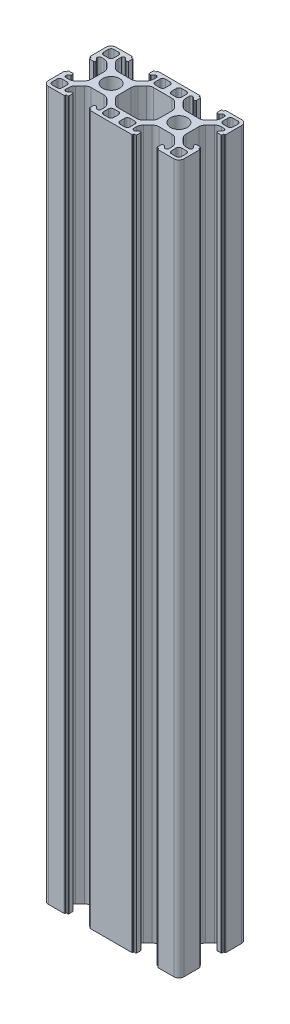
from build123d import *

# Parameters (mm, degrees)
EXTRUDE_1_DEPTH = 209


with BuildPart() as part:
    # Эскиз1 → Бобышка-Вытянуть1 (new body)
    with BuildSketch(Plane(origin=(0, 0, 0), x_dir=(1, 0, 0), z_dir=(0, 1, 0))):
        with BuildLine():
            Line((9.247825015, 4.683728486), (11.146605684, 4.683728486))
            ThreePointArc((11.146605684, 4.683728486), (11.911972549, 4.835969421), (12.560819246, 5.269514923))
            Line((12.560819246, 5.269514923), (13.862038577, 6.570734254))
            ThreePointArc((13.862038577, 6.570734254), (14.29558408, 7.219580952), (14.447825015, 7.984947817))
            Line((14.447825015, 7.984947817), (14.447825015, 8.883728486))
            ThreePointArc((14.447825015, 8.883728486), (14.301378405, 9.237281876), (13.947825015, 9.383728486))
            Line((13.947825015, 9.383728486), (13.844931796, 9.383728486))
            ThreePointArc((13.844931796, 9.383728486), (13.65359008, 9.345668252), (13.491378405, 9.237281876))
            Line((13.491378405, 9.237281876), (13.01104832, 8.75695179))
            ThreePointArc((13.01104832, 8.75695179), (12.929942482, 8.702758603), (12.834271624, 8.683728486))
            Line((12.834271624, 8.683728486), (12.547825015, 8.683728486))
            ThreePointArc((12.547825015, 8.683728486), (12.37104832, 8.75695179), (12.297825015, 8.933728486))
            Line((12.297825015, 8.933728486), (12.297825015, 10.082799306))
            ThreePointArc((12.297825015, 10.082799306), (12.341758998, 10.188865323), (12.447825015, 10.232799306))
            Line((12.447825015, 10.232799306), (12.947825015, 10.232799306))
            Line((12.947825015, 10.232799306), (12.947825015, 10.533728486))
            ThreePointArc((12.947825015, 10.533728486), (12.991758998, 10.639794503), (13.097825015, 10.683728486))
            Line((13.097825015, 10.683728486), (17.747825015, 10.683728486))
            ThreePointArc((17.747825015, 10.683728486), (18.808485187, 10.244388658), (19.247825015, 9.183728486))
            Line((19.247825015, 9.183728486), (19.247825015, 4.533728486))
            ThreePointArc((19.247825015, 4.533728486), (19.203891032, 4.427662469), (19.097825015, 4.383728486))
            Line((19.097825015, 4.383728486), (18.796895835, 4.383728486))
            Line((18.796895835, 4.383728486), (18.796895835, 3.883728486))
            ThreePointArc((18.796895835, 3.883728486), (18.752961853, 3.777662469), (18.646895835, 3.733728486))
            Line((18.646895835, 3.733728486), (17.497825015, 3.733728486))
            ThreePointArc((17.497825015, 3.733728486), (17.32104832, 3.80695179), (17.247825015, 3.983728486))
            Line((17.247825015, 3.983728486), (17.247825015, 4.270175095))
            ThreePointArc((17.247825015, 4.270175095), (17.266855132, 4.365845953), (17.32104832, 4.44695179))
            Line((17.32104832, 4.44695179), (17.801378405, 4.927281876))
            ThreePointArc((17.801378405, 4.927281876), (17.909764781, 5.089493551), (17.947825015, 5.280835267))
            Line((17.947825015, 5.280835267), (17.947825015, 5.383728486))
            ThreePointArc((17.947825015, 5.383728486), (17.801378405, 5.737281876), (17.447825015, 5.883728486))
            Line((17.447825015, 5.883728486), (16.549044346, 5.883728486))
            ThreePointArc((16.549044346, 5.883728486), (15.783677481, 5.731487551), (15.134830783, 5.297942048))
            Line((15.134830783, 5.297942048), (13.833611452, 3.996722717))
            ThreePointArc((13.833611452, 3.996722717), (13.40006595, 3.34787602), (13.247825015, 2.582509155))
            Line((13.247825015, 2.582509155), (13.247825015, 0.683728486))
            Line((13.247825015, 0.683728486), (13.247825015, -1.215052183))
            ThreePointArc((13.247825015, -1.215052183), (13.40006595, -1.980419048), (13.833611452, -2.629265746))
            Line((13.833611452, -2.629265746), (15.134830783, -3.930485077))
            ThreePointArc((15.134830783, -3.930485077), (15.783677481, -4.364030579), (16.549044346, -4.516271514))
            Line((16.549044346, -4.516271514), (17.447825015, -4.516271514))
            ThreePointArc((17.447825015, -4.516271514), (17.801378405, -4.369824905), (17.947825015, -4.016271514))
            Line((17.947825015, -4.016271514), (17.947825015, -3.913378295))
            ThreePointArc((17.947825015, -3.913378295), (17.909764781, -3.722036579), (17.801378405, -3.559824905))
            Line((17.801378405, -3.559824905), (17.32104832, -3.079494819))
            ThreePointArc((17.32104832, -3.079494819), (17.266855132, -2.998388982), (17.247825015, -2.902718124))
            Line((17.247825015, -2.902718124), (17.247825015, -2.616271514))
            ThreePointArc((17.247825015, -2.616271514), (17.32104832, -2.439494819), (17.497825015, -2.366271514))
            Line((17.497825015, -2.366271514), (18.646895835, -2.366271514))
            ThreePointArc((18.646895835, -2.366271514), (18.752961853, -2.410205497), (18.796895835, -2.516271514))
            Line((18.796895835, -2.516271514), (18.796895835, -3.016271514))
            Line((18.796895835, -3.016271514), (19.097825015, -3.016271514))
            ThreePointArc((19.097825015, -3.016271514), (19.203891032, -3.060205497), (19.247825015, -3.166271514))
            Line((19.247825015, -3.166271514), (19.247825015, -7.816271514))
            ThreePointArc((19.247825015, -7.816271514), (18.808485187, -8.876931686), (17.747825015, -9.316271514))
            Line((17.747825015, -9.316271514), (13.097825015, -9.316271514))
            ThreePointArc((13.097825015, -9.316271514), (12.991758998, -9.272337531), (12.947825015, -9.166271514))
            Line((12.947825015, -9.166271514), (12.947825015, -8.865342335))
            Line((12.947825015, -8.865342335), (12.447825015, -8.865342335))
            ThreePointArc((12.447825015, -8.865342335), (12.341758998, -8.821408352), (12.297825015, -8.715342335))
            Line((12.297825015, -8.715342335), (12.297825015, -7.566271514))
            ThreePointArc((12.297825015, -7.566271514), (12.37104832, -7.389494819), (12.547825015, -7.316271514))
            Line((12.547825015, -7.316271514), (12.834271624, -7.316271514))
            ThreePointArc((12.834271624, -7.316271514), (12.929942482, -7.335301631), (13.01104832, -7.389494819))
            Line((13.01104832, -7.389494819), (13.491378405, -7.869824905))
            ThreePointArc((13.491378405, -7.869824905), (13.65359008, -7.978211281), (13.844931796, -8.016271514))
            Line((13.844931796, -8.016271514), (13.947825015, -8.016271514))
            ThreePointArc((13.947825015, -8.016271514), (14.301378405, -7.869824905), (14.447825015, -7.516271514))
            Line((14.447825015, -7.516271514), (14.447825015, -6.617490845))
            ThreePointArc((14.447825015, -6.617490845), (14.29558408, -5.85212398), (13.862038577, -5.203277283))
            Line((13.862038577, -5.203277283), (12.560819246, -3.902057952))
            ThreePointArc((12.560819246, -3.902057952), (11.911972549, -3.468512449), (11.146605684, -3.316271514))
            Line((11.146605684, -3.316271514), (9.247825015, -3.316271514))
            Line((9.247825015, -3.316271514), (7.349044346, -3.316271514))
            ThreePointArc((7.349044346, -3.316271514), (6.583677481, -3.468512449), (5.934830783, -3.902057952))
            Line((5.934830783, -3.902057952), (4.633611452, -5.203277283))
            ThreePointArc((4.633611452, -5.203277283), (4.20006595, -5.85212398), (4.047825015, -6.617490845))
            Line((4.047825015, -6.617490845), (4.047825015, -7.516271514))
            ThreePointArc((4.047825015, -7.516271514), (4.194271624, -7.869824905), (4.547825015, -8.016271514))
            Line((4.547825015, -8.016271514), (4.650718234, -8.016271514))
            ThreePointArc((4.650718234, -8.016271514), (4.84205995, -7.978211281), (5.004271624, -7.869824905))
            Line((5.004271624, -7.869824905), (5.48460171, -7.389494819))
            ThreePointArc((5.48460171, -7.389494819), (5.565707547, -7.335301631), (5.661378405, -7.316271514))
            Line((5.661378405, -7.316271514), (5.947825015, -7.316271514))
            ThreePointArc((5.947825015, -7.316271514), (6.12460171, -7.389494819), (6.197825015, -7.566271514))
            Line((6.197825015, -7.566271514), (6.197825015, -8.715342335))
            ThreePointArc((6.197825015, -8.715342335), (6.153891032, -8.821408352), (6.047825015, -8.865342335))
            Line((6.047825015, -8.865342335), (5.547825015, -8.865342335))
            Line((5.547825015, -8.865342335), (5.547825015, -9.166271514))
            ThreePointArc((5.547825015, -9.166271514), (5.503891032, -9.272337531), (5.397825015, -9.316271514))
            Line((5.397825015, -9.316271514), (0.747825015, -9.316271514))
            Line((0.747825015, -9.316271514), (-2.252174985, -9.316271514))
            Line((-2.252174985, -9.316271514), (-6.902174985, -9.316271514))
            ThreePointArc((-6.902174985, -9.316271514), (-7.008241002, -9.272337531), (-7.052174985, -9.166271514))
            Line((-7.052174985, -9.166271514), (-7.052174985, -8.865342335))
            Line((-7.052174985, -8.865342335), (-7.552174985, -8.865342335))
            ThreePointArc((-7.552174985, -8.865342335), (-7.658241002, -8.821408352), (-7.702174985, -8.715342335))
            Line((-7.702174985, -8.715342335), (-7.702174985, -7.566271514))
            ThreePointArc((-7.702174985, -7.566271514), (-7.62895168, -7.389494819), (-7.452174985, -7.316271514))
            Line((-7.452174985, -7.316271514), (-7.165728376, -7.316271514))
            ThreePointArc((-7.165728376, -7.316271514), (-7.070057518, -7.335301631), (-6.98895168, -7.389494819))
            Line((-6.98895168, -7.389494819), (-6.508621595, -7.869824905))
            ThreePointArc((-6.508621595, -7.869824905), (-6.34640992, -7.978211281), (-6.155068204, -8.016271514))
            Line((-6.155068204, -8.016271514), (-6.052174985, -8.016271514))
            ThreePointArc((-6.052174985, -8.016271514), (-5.698621595, -7.869824905), (-5.552174985, -7.516271514))
            Line((-5.552174985, -7.516271514), (-5.552174985, -6.617490845))
            ThreePointArc((-5.552174985, -6.617490845), (-5.70441592, -5.85212398), (-6.137961423, -5.203277283))
            Line((-6.137961423, -5.203277283), (-7.439180754, -3.902057952))
            ThreePointArc((-7.439180754, -3.902057952), (-8.088027451, -3.468512449), (-8.853394316, -3.316271514))
            Line((-8.853394316, -3.316271514), (-10.752174985, -3.316271514))
            Line((-10.752174985, -3.316271514), (-12.650955654, -3.316271514))
            ThreePointArc((-12.650955654, -3.316271514), (-13.416322519, -3.468512449), (-14.065169217, -3.902057952))
            Line((-14.065169217, -3.902057952), (-15.366388548, -5.203277283))
            ThreePointArc((-15.366388548, -5.203277283), (-15.79993405, -5.85212398), (-15.952174985, -6.617490845))
            Line((-15.952174985, -6.617490845), (-15.952174985, -7.516271514))
            ThreePointArc((-15.952174985, -7.516271514), (-15.805728376, -7.869824905), (-15.452174985, -8.016271514))
            Line((-15.452174985, -8.016271514), (-15.349281766, -8.016271514))
            ThreePointArc((-15.349281766, -8.016271514), (-15.15794005, -7.978211281), (-14.995728376, -7.869824905))
            Line((-14.995728376, -7.869824905), (-14.51539829, -7.389494819))
            ThreePointArc((-14.51539829, -7.389494819), (-14.434292453, -7.335301631), (-14.338621595, -7.316271514))
            Line((-14.338621595, -7.316271514), (-14.052174985, -7.316271514))
            ThreePointArc((-14.052174985, -7.316271514), (-13.87539829, -7.389494819), (-13.802174985, -7.566271514))
            Line((-13.802174985, -7.566271514), (-13.802174985, -8.715342335))
            ThreePointArc((-13.802174985, -8.715342335), (-13.846108968, -8.821408352), (-13.952174985, -8.865342335))
            Line((-13.952174985, -8.865342335), (-14.452174985, -8.865342335))
            Line((-14.452174985, -8.865342335), (-14.452174985, -9.166271514))
            ThreePointArc((-14.452174985, -9.166271514), (-14.496108968, -9.272337531), (-14.602174985, -9.316271514))
            Line((-14.602174985, -9.316271514), (-19.252174985, -9.316271514))
            ThreePointArc((-19.252174985, -9.316271514), (-20.312835157, -8.876931686), (-20.752174985, -7.816271514))
            Line((-20.752174985, -7.816271514), (-20.752174985, -3.166271514))
            ThreePointArc((-20.752174985, -3.166271514), (-20.708241002, -3.060205497), (-20.602174985, -3.016271514))
            Line((-20.602174985, -3.016271514), (-20.301245806, -3.016271514))
            Line((-20.301245806, -3.016271514), (-20.301245806, -2.516271514))
            ThreePointArc((-20.301245806, -2.516271514), (-20.257311823, -2.410205497), (-20.151245806, -2.366271514))
            Line((-20.151245806, -2.366271514), (-19.002174985, -2.366271514))
            ThreePointArc((-19.002174985, -2.366271514), (-18.82539829, -2.439494819), (-18.752174985, -2.616271514))
            Line((-18.752174985, -2.616271514), (-18.752174985, -2.902718124))
            ThreePointArc((-18.752174985, -2.902718124), (-18.771205102, -2.998388982), (-18.82539829, -3.079494819))
            Line((-18.82539829, -3.079494819), (-19.305728376, -3.559824905))
            ThreePointArc((-19.305728376, -3.559824905), (-19.414114751, -3.722036579), (-19.452174985, -3.913378295))
            Line((-19.452174985, -3.913378295), (-19.452174985, -4.016271514))
            ThreePointArc((-19.452174985, -4.016271514), (-19.305728376, -4.369824905), (-18.952174985, -4.516271514))
            Line((-18.952174985, -4.516271514), (-18.053394316, -4.516271514))
            ThreePointArc((-18.053394316, -4.516271514), (-17.288027451, -4.364030579), (-16.639180754, -3.930485077))
            Line((-16.639180754, -3.930485077), (-15.337961423, -2.629265746))
            ThreePointArc((-15.337961423, -2.629265746), (-14.90441592, -1.980419048), (-14.752174985, -1.215052183))
            Line((-14.752174985, -1.215052183), (-14.752174985, 0.683728486))
            Line((-14.752174985, 0.683728486), (-14.752174985, 2.582509155))
            ThreePointArc((-14.752174985, 2.582509155), (-14.90441592, 3.34787602), (-15.337961423, 3.996722717))
            Line((-15.337961423, 3.996722717), (-16.639180754, 5.297942048))
            ThreePointArc((-16.639180754, 5.297942048), (-17.288027451, 5.731487551), (-18.053394316, 5.883728486))
            Line((-18.053394316, 5.883728486), (-18.952174985, 5.883728486))
            ThreePointArc((-18.952174985, 5.883728486), (-19.305728376, 5.737281876), (-19.452174985, 5.383728486))
            Line((-19.452174985, 5.383728486), (-19.452174985, 5.280835267))
            ThreePointArc((-19.452174985, 5.280835267), (-19.414114751, 5.089493551), (-19.305728376, 4.927281876))
            Line((-19.305728376, 4.927281876), (-18.82539829, 4.44695179))
            ThreePointArc((-18.82539829, 4.44695179), (-18.771205102, 4.365845953), (-18.752174985, 4.270175095))
            Line((-18.752174985, 4.270175095), (-18.752174985, 3.983728486))
            ThreePointArc((-18.752174985, 3.983728486), (-18.82539829, 3.80695179), (-19.002174985, 3.733728486))
            Line((-19.002174985, 3.733728486), (-20.151245806, 3.733728486))
            ThreePointArc((-20.151245806, 3.733728486), (-20.257311823, 3.777662469), (-20.301245806, 3.883728486))
            Line((-20.301245806, 3.883728486), (-20.301245806, 4.383728486))
            Line((-20.301245806, 4.383728486), (-20.602174985, 4.383728486))
            ThreePointArc((-20.602174985, 4.383728486), (-20.708241002, 4.427662469), (-20.752174985, 4.533728486))
            Line((-20.752174985, 4.533728486), (-20.752174985, 9.183728486))
            ThreePointArc((-20.752174985, 9.183728486), (-20.312835157, 10.244388658), (-19.252174985, 10.683728486))
            Line((-19.252174985, 10.683728486), (-14.602174985, 10.683728486))
            ThreePointArc((-14.602174985, 10.683728486), (-14.496108968, 10.639794503), (-14.452174985, 10.533728486))
            Line((-14.452174985, 10.533728486), (-14.452174985, 10.232799306))
            Line((-14.452174985, 10.232799306), (-13.952174985, 10.232799306))
            ThreePointArc((-13.952174985, 10.232799306), (-13.846108968, 10.188865323), (-13.802174985, 10.082799306))
            Line((-13.802174985, 10.082799306), (-13.802174985, 8.933728486))
            ThreePointArc((-13.802174985, 8.933728486), (-13.87539829, 8.75695179), (-14.052174985, 8.683728486))
            Line((-14.052174985, 8.683728486), (-14.338621595, 8.683728486))
            ThreePointArc((-14.338621595, 8.683728486), (-14.434292453, 8.702758603), (-14.51539829, 8.75695179))
            Line((-14.51539829, 8.75695179), (-14.995728376, 9.237281876))
            ThreePointArc((-14.995728376, 9.237281876), (-15.15794005, 9.345668252), (-15.349281766, 9.383728486))
            Line((-15.349281766, 9.383728486), (-15.452174985, 9.383728486))
            ThreePointArc((-15.452174985, 9.383728486), (-15.805728376, 9.237281876), (-15.952174985, 8.883728486))
            Line((-15.952174985, 8.883728486), (-15.952174985, 7.984947817))
            ThreePointArc((-15.952174985, 7.984947817), (-15.79993405, 7.219580952), (-15.366388548, 6.570734254))
            Line((-15.366388548, 6.570734254), (-14.065169217, 5.269514923))
            ThreePointArc((-14.065169217, 5.269514923), (-13.416322519, 4.835969421), (-12.650955654, 4.683728486))
            Line((-12.650955654, 4.683728486), (-10.752174985, 4.683728486))
            Line((-10.752174985, 4.683728486), (-8.853394316, 4.683728486))
            ThreePointArc((-8.853394316, 4.683728486), (-8.088027451, 4.835969421), (-7.439180754, 5.269514923))
            Line((-7.439180754, 5.269514923), (-6.137961423, 6.570734254))
            ThreePointArc((-6.137961423, 6.570734254), (-5.70441592, 7.219580952), (-5.552174985, 7.984947817))
            Line((-5.552174985, 7.984947817), (-5.552174985, 8.883728486))
            ThreePointArc((-5.552174985, 8.883728486), (-5.698621595, 9.237281876), (-6.052174985, 9.383728486))
            Line((-6.052174985, 9.383728486), (-6.155068204, 9.383728486))
            ThreePointArc((-6.155068204, 9.383728486), (-6.34640992, 9.345668252), (-6.508621595, 9.237281876))
            Line((-6.508621595, 9.237281876), (-6.98895168, 8.75695179))
            ThreePointArc((-6.98895168, 8.75695179), (-7.070057518, 8.702758603), (-7.165728376, 8.683728486))
            Line((-7.165728376, 8.683728486), (-7.452174985, 8.683728486))
            ThreePointArc((-7.452174985, 8.683728486), (-7.62895168, 8.75695179), (-7.702174985, 8.933728486))
            Line((-7.702174985, 8.933728486), (-7.702174985, 10.082799306))
            ThreePointArc((-7.702174985, 10.082799306), (-7.658241002, 10.188865323), (-7.552174985, 10.232799306))
            Line((-7.552174985, 10.232799306), (-7.052174985, 10.232799306))
            Line((-7.052174985, 10.232799306), (-7.052174985, 10.533728486))
            ThreePointArc((-7.052174985, 10.533728486), (-7.008241002, 10.639794503), (-6.902174985, 10.683728486))
            Line((-6.902174985, 10.683728486), (-2.252174985, 10.683728486))
            Line((-2.252174985, 10.683728486), (0.747825015, 10.683728486))
            Line((0.747825015, 10.683728486), (5.397825015, 10.683728486))
            ThreePointArc((5.397825015, 10.683728486), (5.503891032, 10.639794503), (5.547825015, 10.533728486))
            Line((5.547825015, 10.533728486), (5.547825015, 10.232799306))
            Line((5.547825015, 10.232799306), (6.047825015, 10.232799306))
            ThreePointArc((6.047825015, 10.232799306), (6.153891032, 10.188865323), (6.197825015, 10.082799306))
            Line((6.197825015, 10.082799306), (6.197825015, 8.933728486))
            ThreePointArc((6.197825015, 8.933728486), (6.12460171, 8.75695179), (5.947825015, 8.683728486))
            Line((5.947825015, 8.683728486), (5.661378405, 8.683728486))
            ThreePointArc((5.661378405, 8.683728486), (5.565707547, 8.702758603), (5.48460171, 8.75695179))
            Line((5.48460171, 8.75695179), (5.004271624, 9.237281876))
            ThreePointArc((5.004271624, 9.237281876), (4.84205995, 9.345668252), (4.650718234, 9.383728486))
            Line((4.650718234, 9.383728486), (4.547825015, 9.383728486))
            ThreePointArc((4.547825015, 9.383728486), (4.194271624, 9.237281876), (4.047825015, 8.883728486))
            Line((4.047825015, 8.883728486), (4.047825015, 7.984947817))
            ThreePointArc((4.047825015, 7.984947817), (4.20006595, 7.219580952), (4.633611452, 6.570734254))
            Line((4.633611452, 6.570734254), (5.934830783, 5.269514923))
            ThreePointArc((5.934830783, 5.269514923), (6.583677481, 4.835969421), (7.349044346, 4.683728486))
            Line((7.349044346, 4.683728486), (9.247825015, 4.683728486))
        make_face()
        with BuildLine():
            Line((16.147825015, 6.783728486), (17.547825015, 6.783728486))
            ThreePointArc((17.547825015, 6.783728486), (18.11351044, 7.018043061), (18.347825015, 7.583728486))
            Line((18.347825015, 7.583728486), (18.347825015, 8.983728486))
            ThreePointArc((18.347825015, 8.983728486), (18.11351044, 9.549413911), (17.547825015, 9.783728486))
            Line((17.547825015, 9.783728486), (16.147825015, 9.783728486))
            ThreePointArc((16.147825015, 9.783728486), (15.58213959, 9.549413911), (15.347825015, 8.983728486))
            Line((15.347825015, 8.983728486), (15.347825015, 7.583728486))
            ThreePointArc((15.347825015, 7.583728486), (15.58213959, 7.018043061), (16.147825015, 6.783728486))
        make_face(mode=Mode.SUBTRACT)
        with BuildLine():
            Line((15.347825015, -6.216271514), (15.347825015, -7.616271514))
            ThreePointArc((15.347825015, -7.616271514), (15.58213959, -8.181956939), (16.147825015, -8.416271514))
            Line((16.147825015, -8.416271514), (17.547825015, -8.416271514))
            ThreePointArc((17.547825015, -8.416271514), (18.11351044, -8.181956939), (18.347825015, -7.616271514))
            Line((18.347825015, -7.616271514), (18.347825015, -6.216271514))
            ThreePointArc((18.347825015, -6.216271514), (18.11351044, -5.650586089), (17.547825015, -5.416271514))
            Line((17.547825015, -5.416271514), (16.147825015, -5.416271514))
            ThreePointArc((16.147825015, -5.416271514), (15.58213959, -5.650586089), (15.347825015, -6.216271514))
        make_face(mode=Mode.SUBTRACT)
        with BuildLine():
            Line((2.347825015, -5.416271514), (0.947825015, -5.416271514))
            ThreePointArc((0.947825015, -5.416271514), (0.38213959, -5.650586089), (0.147825015, -6.216271514))
            Line((0.147825015, -6.216271514), (0.147825015, -7.616271514))
            ThreePointArc((0.147825015, -7.616271514), (0.38213959, -8.181956939), (0.947825015, -8.416271514))
            Line((0.947825015, -8.416271514), (2.347825015, -8.416271514))
            ThreePointArc((2.347825015, -8.416271514), (2.91351044, -8.181956939), (3.147825015, -7.616271514))
            Line((3.147825015, -7.616271514), (3.147825015, -6.216271514))
            ThreePointArc((3.147825015, -6.216271514), (2.91351044, -5.650586089), (2.347825015, -5.416271514))
        make_face(mode=Mode.SUBTRACT)
        with BuildLine():
            Line((1.047825015, -4.516271514), (1.946605684, -4.516271514))
            ThreePointArc((1.946605684, -4.516271514), (2.711972549, -4.364030579), (3.360819246, -3.930485077))
            Line((3.360819246, -3.930485077), (4.662038577, -2.629265746))
            ThreePointArc((4.662038577, -2.629265746), (5.09558408, -1.980419048), (5.247825015, -1.215052183))
            Line((5.247825015, -1.215052183), (5.247825015, 0.683728486))
            Line((5.247825015, 0.683728486), (5.247825015, 2.582509155))
            ThreePointArc((5.247825015, 2.582509155), (5.09558408, 3.34787602), (4.662038577, 3.996722717))
            Line((4.662038577, 3.996722717), (3.360819246, 5.297942048))
            ThreePointArc((3.360819246, 5.297942048), (2.711972549, 5.731487551), (1.946605684, 5.883728486))
            Line((1.946605684, 5.883728486), (1.047825015, 5.883728486))
            Line((1.047825015, 5.883728486), (-2.552174985, 5.883728486))
            Line((-2.552174985, 5.883728486), (-3.450955654, 5.883728486))
            ThreePointArc((-3.450955654, 5.883728486), (-4.216322519, 5.731487551), (-4.865169217, 5.297942048))
            Line((-4.865169217, 5.297942048), (-6.166388548, 3.996722717))
            ThreePointArc((-6.166388548, 3.996722717), (-6.59993405, 3.34787602), (-6.752174985, 2.582509155))
            Line((-6.752174985, 2.582509155), (-6.752174985, 0.683728486))
            Line((-6.752174985, 0.683728486), (-6.752174985, -1.215052183))
            ThreePointArc((-6.752174985, -1.215052183), (-6.59993405, -1.980419048), (-6.166388548, -2.629265746))
            Line((-6.166388548, -2.629265746), (-4.865169217, -3.930485077))
            ThreePointArc((-4.865169217, -3.930485077), (-4.216322519, -4.364030579), (-3.450955654, -4.516271514))
            Line((-3.450955654, -4.516271514), (-2.552174985, -4.516271514))
            Line((-2.552174985, -4.516271514), (1.047825015, -4.516271514))
        make_face(mode=Mode.SUBTRACT)
        with BuildLine():
            Line((3.147825015, 7.583728486), (3.147825015, 8.983728486))
            ThreePointArc((3.147825015, 8.983728486), (2.91351044, 9.549413911), (2.347825015, 9.783728486))
            Line((2.347825015, 9.783728486), (0.947825015, 9.783728486))
            ThreePointArc((0.947825015, 9.783728486), (0.38213959, 9.549413911), (0.147825015, 8.983728486))
            Line((0.147825015, 8.983728486), (0.147825015, 7.583728486))
            ThreePointArc((0.147825015, 7.583728486), (0.38213959, 7.018043061), (0.947825015, 6.783728486))
            Line((0.947825015, 6.783728486), (2.347825015, 6.783728486))
            ThreePointArc((2.347825015, 6.783728486), (2.91351044, 7.018043061), (3.147825015, 7.583728486))
        make_face(mode=Mode.SUBTRACT)
        with BuildLine():
            Line((-2.452174985, 9.783728486), (-3.852174985, 9.783728486))
            ThreePointArc((-3.852174985, 9.783728486), (-4.41786041, 9.549413911), (-4.652174985, 8.983728486))
            Line((-4.652174985, 8.983728486), (-4.652174985, 7.583728486))
            ThreePointArc((-4.652174985, 7.583728486), (-4.41786041, 7.018043061), (-3.852174985, 6.783728486))
            Line((-3.852174985, 6.783728486), (-2.452174985, 6.783728486))
            ThreePointArc((-2.452174985, 6.783728486), (-1.88648956, 7.018043061), (-1.652174985, 7.583728486))
            Line((-1.652174985, 7.583728486), (-1.652174985, 8.983728486))
            ThreePointArc((-1.652174985, 8.983728486), (-1.88648956, 9.549413911), (-2.452174985, 9.783728486))
        make_face(mode=Mode.SUBTRACT)
        with BuildLine():
            Line((-1.652174985, -7.616271514), (-1.652174985, -6.216271514))
            ThreePointArc((-1.652174985, -6.216271514), (-1.88648956, -5.650586089), (-2.452174985, -5.416271514))
            Line((-2.452174985, -5.416271514), (-3.852174985, -5.416271514))
            ThreePointArc((-3.852174985, -5.416271514), (-4.41786041, -5.650586089), (-4.652174985, -6.216271514))
            Line((-4.652174985, -6.216271514), (-4.652174985, -7.616271514))
            ThreePointArc((-4.652174985, -7.616271514), (-4.41786041, -8.181956939), (-3.852174985, -8.416271514))
            Line((-3.852174985, -8.416271514), (-2.452174985, -8.416271514))
            ThreePointArc((-2.452174985, -8.416271514), (-1.88648956, -8.181956939), (-1.652174985, -7.616271514))
        make_face(mode=Mode.SUBTRACT)
        with BuildLine():
            Line((-19.052174985, -8.416271514), (-17.652174985, -8.416271514))
            ThreePointArc((-17.652174985, -8.416271514), (-17.08648956, -8.181956939), (-16.852174985, -7.616271514))
            Line((-16.852174985, -7.616271514), (-16.852174985, -6.216271514))
            ThreePointArc((-16.852174985, -6.216271514), (-17.08648956, -5.650586089), (-17.652174985, -5.416271514))
            Line((-17.652174985, -5.416271514), (-19.052174985, -5.416271514))
            ThreePointArc((-19.052174985, -5.416271514), (-19.61786041, -5.650586089), (-19.852174985, -6.216271514))
            Line((-19.852174985, -6.216271514), (-19.852174985, -7.616271514))
            ThreePointArc((-19.852174985, -7.616271514), (-19.61786041, -8.181956939), (-19.052174985, -8.416271514))
        make_face(mode=Mode.SUBTRACT)
        with BuildLine():
            Line((-19.852174985, 8.983728486), (-19.852174985, 7.583728486))
            ThreePointArc((-19.852174985, 7.583728486), (-19.61786041, 7.018043061), (-19.052174985, 6.783728486))
            Line((-19.052174985, 6.783728486), (-17.652174985, 6.783728486))
            ThreePointArc((-17.652174985, 6.783728486), (-17.08648956, 7.018043061), (-16.852174985, 7.583728486))
            Line((-16.852174985, 7.583728486), (-16.852174985, 8.983728486))
            ThreePointArc((-16.852174985, 8.983728486), (-17.08648956, 9.549413911), (-17.652174985, 9.783728486))
            Line((-17.652174985, 9.783728486), (-19.052174985, 9.783728486))
            ThreePointArc((-19.052174985, 9.783728486), (-19.61786041, 9.549413911), (-19.852174985, 8.983728486))
        make_face(mode=Mode.SUBTRACT)
        with BuildLine():
            ThreePointArc((11.747825015, 0.683728486), (11.015591968, 2.451495439), (9.247825015, 3.183728486))
            ThreePointArc((9.247825015, 3.183728486), (7.480058062, 2.451495439), (6.747825015, 0.683728486))
            ThreePointArc((6.747825015, 0.683728486), (7.480058062, -1.084038467), (9.247825015, -1.816271514))
            ThreePointArc((9.247825015, -1.816271514), (11.015591968, -1.084038467), (11.747825015, 0.683728486))
        make_face(mode=Mode.SUBTRACT)
        with BuildLine():
            ThreePointArc((-10.752174985, 3.183728486), (-8.984408032, 2.451495439), (-8.252174985, 0.683728486))
            ThreePointArc((-8.252174985, 0.683728486), (-8.984408032, -1.084038467), (-10.752174985, -1.816271514))
            ThreePointArc((-10.752174985, -1.816271514), (-12.519941938, -1.084038467), (-13.252174985, 0.683728486))
            ThreePointArc((-13.252174985, 0.683728486), (-12.519941938, 2.451495439), (-10.752174985, 3.183728486))
        make_face(mode=Mode.SUBTRACT)
    extrude(amount=EXTRUDE_1_DEPTH)


solid = part.part
